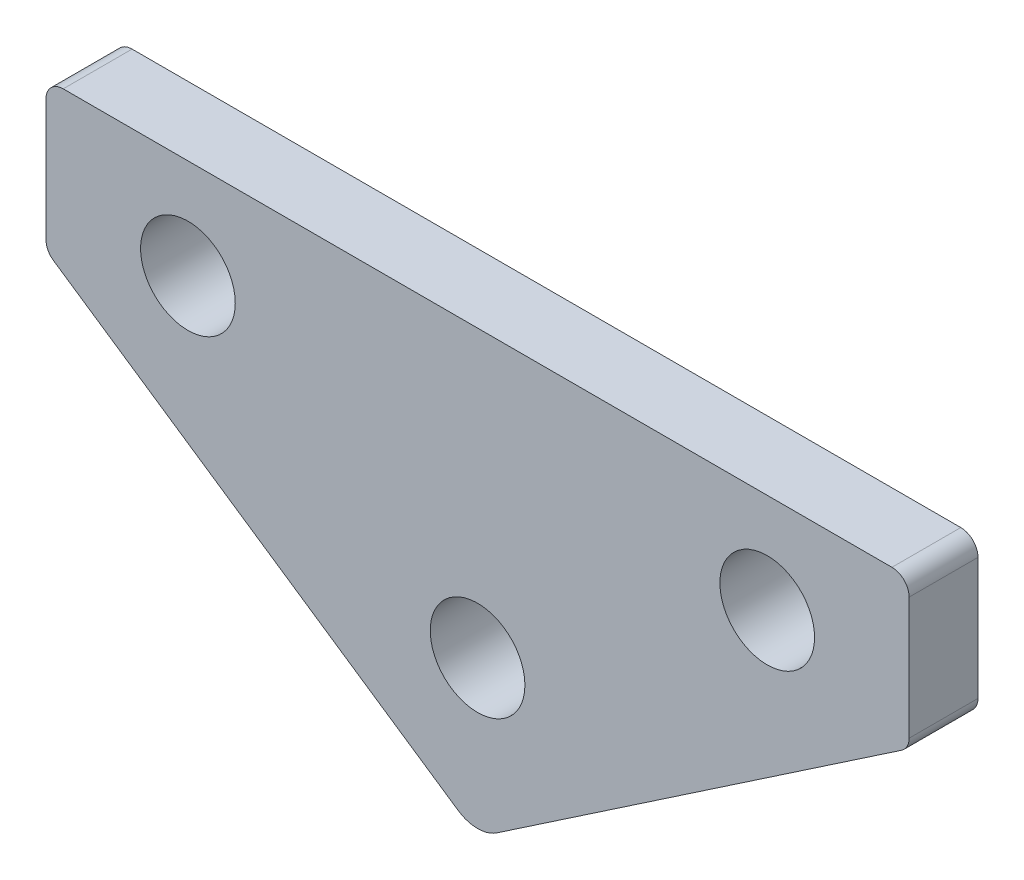
from build123d import *

# Parameters (mm, degrees)
SKETCH1_R           = 2.75
BOSS_EXTRUDE1_DEPTH = 4


with BuildPart() as part:
    # Sketch1 → Boss-Extrude1 (new body)
    with BuildSketch(Plane.XY):
        with BuildLine():
            Line((24.072178339, 16.5927117), (-24.072178339, 16.5927117))
            ThreePointArc((-24.072178339, 16.5927117), (-24.779285121, 16.299818481), (-25.072178339, 15.5927117))
            Line((-25.072178339, 15.5927117), (-25.072178339, 8.49545414))
            ThreePointArc((-25.072178339, 8.49545414), (-24.955491664, 8.026671065), (-24.632663198, 7.667289468))
            Line((-24.632663198, 7.667289468), (-1.120969717, -8.244942286))
            ThreePointArc((-1.120969717, -8.244942286), (0, -8.588612943), (1.120969717, -8.244942286))
            Line((1.120969717, -8.244942286), (24.632663198, 7.667289468))
            ThreePointArc((24.632663198, 7.667289468), (24.955491664, 8.026671065), (25.072178339, 8.49545414))
            Line((25.072178339, 8.49545414), (25.072178339, 15.5927117))
            ThreePointArc((25.072178339, 15.5927117), (24.779285121, 16.299818481), (24.072178339, 16.5927117))
        make_face()
        Circle(SKETCH1_R, mode=Mode.SUBTRACT)
        with Locations((-16.827094957, 10.809665828)):
            Circle(SKETCH1_R, mode=Mode.SUBTRACT)
        with Locations((16.827094957, 10.809665828)):
            Circle(SKETCH1_R, mode=Mode.SUBTRACT)
    extrude(amount=BOSS_EXTRUDE1_DEPTH)


solid = part.part
